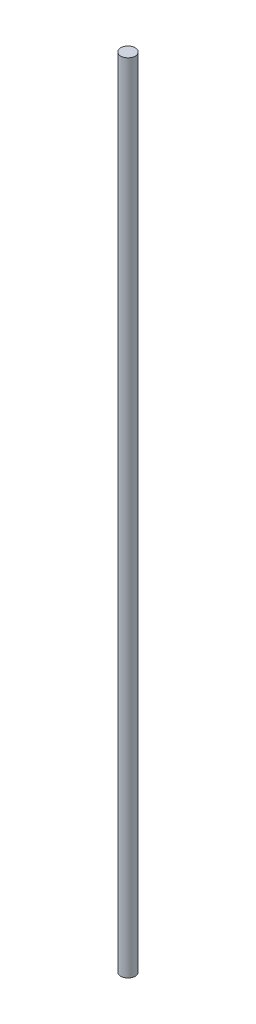
from build123d import *

# Parameters (mm, degrees)
SKETCH_1_R      = 0.1
EXTRUDE_1_DEPTH = 11


with BuildPart() as part:
    # Эскиз1 → Бобышка-Вытянуть1 (new body)
    with BuildSketch(Plane(origin=(0, 0, 0), x_dir=(1, 0, 0), z_dir=(0, 1, 0))):
        with Locations(Location((0, 0, 0), (0, 0, 270))):
            Circle(SKETCH_1_R)
    extrude(amount=EXTRUDE_1_DEPTH)


solid = part.part
